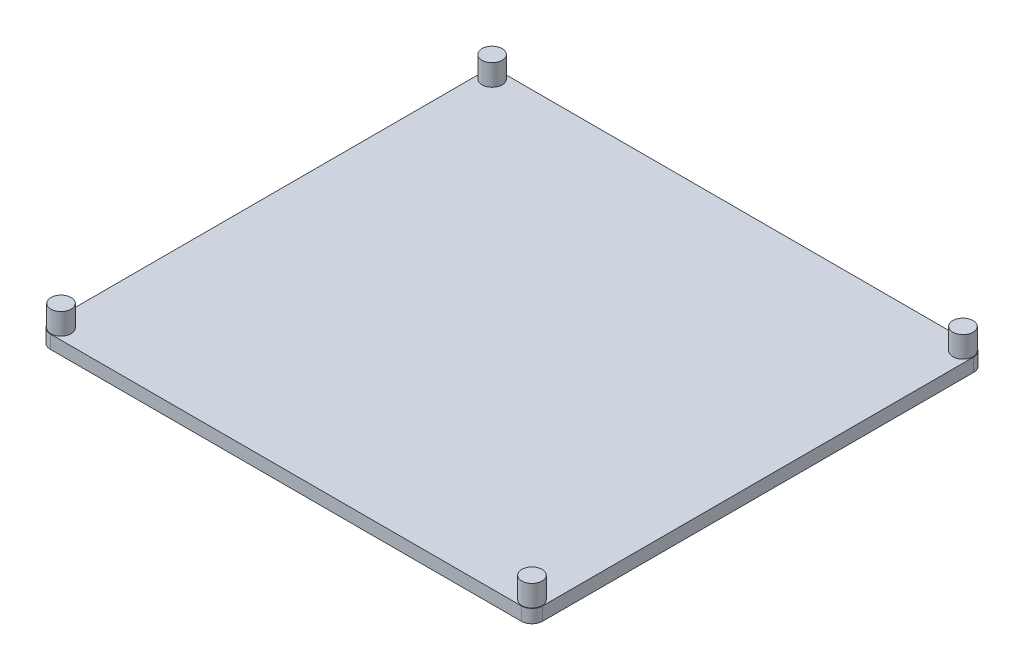
from build123d import *

# Parameters (mm, degrees)
BOSS_EXTRUDE1_DEPTH = 2.5
SKETCH3_R           = 1.9
BOSS_EXTRUDE2_DEPTH = 4
CUT_EXTRUDE1_DEPTH  = 1.5


with BuildPart() as part:
    # Sketch1 → Boss-Extrude1 (new body)
    with BuildSketch(Plane(origin=(0, 0, 0), x_dir=(1, 0, 0), z_dir=(0, 1, 0))):
        with BuildLine():
            Line((0, 0), (88.5, 0))
            ThreePointArc((88.5, 0), (89.914213562, 0.585786438), (90.5, 2))
            Line((90.5, 2), (90.5, 83))
            ThreePointArc((90.5, 83), (89.914213562, 84.414213562), (88.5, 85))
            Line((88.5, 85), (0, 85))
            ThreePointArc((0, 85), (-1.414213562, 84.414213562), (-2, 83))
            Line((-2, 83), (-2, 2))
            ThreePointArc((-2, 2), (-1.414213562, 0.585786438), (0, 0))
        make_face()
    extrude(amount=BOSS_EXTRUDE1_DEPTH)

    # Sketch3 → Boss-Extrude2 (add)
    with BuildSketch(Plane(origin=(0, 2.5, 0), x_dir=(1, 0, 0), z_dir=(0, 1, 0))):
        with Locations(Location((0, 83, 0), (0, 0, 270))):
            Circle(SKETCH3_R)
        with Locations(Location((88.5, 83, 0), (0, 0, 270))):
            Circle(SKETCH3_R)
        with Locations(Location((88.5, 2, 0), (0, 0, 270))):
            Circle(SKETCH3_R)
        with Locations(Location((0, 2, 0), (0, 0, 270))):
            Circle(SKETCH3_R)
    extrude(amount=BOSS_EXTRUDE2_DEPTH)

    # Sketch4 → Cut-Extrude1 (cut)
    # profile 1 of 7: a face of its own
    with BuildSketch(Plane.XZ):
        with BuildLine():
            Line((54.173268609, -47.534433423), (53.197707712, -47.534433423))
            add(Edge.make_bspline(
                [(53.197707712, -47.534433423), (53.14995199, -47.534186304), (53.057389515, -47.533707325), (52.922800548, -47.526106278), (52.796695362, -47.516001404), (52.679296801, -47.499051023), (52.569840971, -47.481475713), (52.469439078, -47.455679366), (52.377250132, -47.427186361), (52.266550076, -47.383346005), (52.140945694, -47.315261381), (52.005944486, -47.214285413), (51.888593199, -47.093223381), (51.78880982, -46.955263647), (51.708731536, -46.803492306), (51.651531343, -46.641174767), (51.614783762, -46.471041829), (51.611052011, -46.354399969), (51.609166045, -46.295451051)],
                knots=[0, 0, 0, 0, 1.00128172, 1.940733171, 2.826250472, 3.653024905, 4.427672124, 5.149348099, 5.824709082, 6.450061444, 7.643590664, 8.808605388, 9.972104426, 11.165284501, 12.367876273, 13.557044126, 14.765369432, 16, 16, 16, 16], degree=3))
            add(Edge.make_bspline(
                [(51.609166045, -46.295451051), (51.610706529, -46.240226063), (51.613733725, -46.131703753), (51.643306985, -45.973509427), (51.687947104, -45.822448027), (51.752365506, -45.679975325), (51.834504382, -45.547343225), (51.934438668, -45.426814093), (52.052933341, -45.320754311), (52.141899796, -45.261730533), (52.187090724, -45.231749128)],
                knots=[0, 0, 0, 0, 1.044356178, 2.052258378, 3.035953355, 4.020338374, 5.002448483, 5.980768927, 6.974322109, 8, 8, 8, 8], degree=3))
            add(Edge.make_bspline(
                [(52.187090724, -45.231749128), (52.130286082, -45.209951764), (52.021604731, -45.168248008), (51.871851615, -45.094230684), (51.742785615, -45.014342591), (51.632743424, -44.927998173), (51.540535844, -44.83237804), (51.458393628, -44.730000413), (51.388682055, -44.617299826), (51.32920253, -44.496718448), (51.282085295, -44.368894832), (51.249379382, -44.234785252), (51.228637187, -44.095908684), (51.225924767, -44.001520926), (51.22455066, -43.953704257)],
                knots=[0, 0, 0, 0, 1.272200328, 2.434034374, 3.488177493, 4.442517805, 5.351202203, 6.260825393, 7.183200622, 8.11705787, 9.069326169, 10.026320267, 11.000137371, 12, 12, 12, 12], degree=3))
            add(Edge.make_bspline(
                [(51.22455066, -43.953704257), (51.225946289, -43.90489452), (51.228692226, -43.808859997), (51.248947416, -43.667780074), (51.283253171, -43.532962984), (51.330471797, -43.403511327), (51.392023652, -43.280183265), (51.466384691, -43.162009574), (51.55563362, -43.050741608), (51.656136693, -42.94476473), (51.768269207, -42.847853454), (51.891830464, -42.76457109), (52.023653719, -42.692636688), (52.165544132, -42.634805464), (52.316494895, -42.589534193), (52.476541369, -42.558233711), (52.645592676, -42.537058739), (52.76160829, -42.535323377), (52.821105147, -42.534433423)],
                knots=[0, 0, 0, 0, 0.978522333, 1.925270105, 2.85076145, 3.763600118, 4.682725947, 5.609499657, 6.557784645, 7.537954401, 8.534920712, 9.522742111, 10.520247711, 11.5409147, 12.58930695, 13.675078472, 14.807699069, 16, 16, 16, 16], degree=3))
            Line((52.821105147, -42.534433423), (54.173268609, -42.534433423))
            Line((54.173268609, -42.534433423), (54.173268609, -47.534433423))
        make_face()
        with BuildLine():
            Line((53.72455066, -47.02161291), (53.72455066, -45.419048808))
            Line((53.72455066, -45.419048808), (53.423068288, -45.419048808))
            add(Edge.make_bspline(
                [(53.423068288, -45.419048808), (53.378998184, -45.419615372), (53.293845761, -45.42071009), (53.170203918, -45.423944774), (53.055722029, -45.432605396), (52.950005636, -45.441765448), (52.853763215, -45.455869994), (52.766672838, -45.473130179), (52.687951298, -45.49122425), (52.597212036, -45.522084933), (52.494298153, -45.567216366), (52.385357174, -45.638971791), (52.287305396, -45.722049059), (52.206418338, -45.820591682), (52.139076927, -45.927008802), (52.093738569, -46.042093976), (52.06212698, -46.161881337), (52.05931281, -46.244492897), (52.057883994, -46.286436628)],
                knots=[0, 0, 0, 0, 1.156584208, 2.234756387, 3.244705828, 4.168772894, 5.018724976, 5.795346628, 6.498686023, 7.135894168, 8.308330183, 9.43588092, 10.547699294, 11.667188675, 12.76860303, 13.837480448, 14.902040606, 16, 16, 16, 16], degree=3))
            add(Edge.make_bspline(
                [(52.057883994, -46.286436628), (52.058580851, -46.314204294), (52.059947812, -46.368673602), (52.072834694, -46.448032256), (52.090618438, -46.523550332), (52.119948262, -46.593191997), (52.154696523, -46.659402654), (52.199235493, -46.720090836), (52.250593024, -46.776900591), (52.310469468, -46.828309188), (52.378620061, -46.874805297), (52.457203656, -46.913511087), (52.544083754, -46.947908452), (52.641072078, -46.973982459), (52.746236709, -46.996618849), (52.861182085, -47.010893231), (52.985215466, -47.020063319), (53.071153466, -47.021084859), (53.115576301, -47.02161291)],
                knots=[0, 0, 0, 0, 0.911412742, 1.787835618, 2.63643285, 3.453173233, 4.262886967, 5.08783453, 5.918594724, 6.773969545, 7.67442701, 8.62112486, 9.645634318, 10.739428598, 11.916091468, 13.177237585, 14.540865421, 16, 16, 16, 16], degree=3))
            Line((53.115576301, -47.02161291), (53.72455066, -47.02161291))
        make_face(mode=Mode.SUBTRACT)
        with BuildLine():
            Line((53.72455066, -44.906228295), (53.72455066, -43.047253936))
            Line((53.72455066, -43.047253936), (53.085528224, -43.047253936))
            add(Edge.make_bspline(
                [(53.085528224, -43.047253936), (53.039791474, -43.047854861), (52.951639918, -43.049013065), (52.824267388, -43.051761323), (52.706839664, -43.06195735), (52.598379037, -43.071732673), (52.499387345, -43.087702691), (52.408901723, -43.10316718), (52.328988905, -43.12592394), (52.235486293, -43.157237643), (52.130904562, -43.207281093), (52.016696376, -43.280874271), (51.916102722, -43.370516185), (51.830756055, -43.473733761), (51.759794043, -43.584804511), (51.710702345, -43.70394704), (51.67889372, -43.827181796), (51.675147421, -43.911445202), (51.673268609, -43.953704257)],
                knots=[0, 0, 0, 0, 1.16016216, 2.236059617, 3.229676189, 4.14889023, 4.996733752, 5.772278665, 6.474820656, 7.101410824, 8.271817372, 9.403828207, 10.537358096, 11.673541442, 12.791884111, 13.865947414, 14.929748409, 16, 16, 16, 16], degree=3))
            add(Edge.make_bspline(
                [(51.673268609, -43.953704257), (51.673652132, -43.980127277), (51.674412992, -44.032547112), (51.686372952, -44.109511941), (51.702970316, -44.184435015), (51.72743017, -44.256298631), (51.757019942, -44.326340269), (51.796056391, -44.392280901), (51.840089215, -44.456927518), (51.908289402, -44.539617697), (52.008839875, -44.633740697), (52.151775922, -44.724741472), (52.313390477, -44.799319444), (52.430883859, -44.830847279), (52.491577904, -44.847133744)],
                knots=[0, 0, 0, 0, 0.723354195, 1.435040621, 2.129761981, 2.824182007, 3.512608497, 4.209435533, 4.920062464, 5.654614313, 7.143585817, 8.671381114, 10.280521501, 12, 12, 12, 12], degree=3))
            add(Edge.make_bspline(
                [(52.491577904, -44.847133744), (52.515905161, -44.85206991), (52.568651672, -44.862772536), (52.654662938, -44.874062875), (52.7531863, -44.884190677), (52.863800651, -44.891485523), (52.986945919, -44.899316414), (53.122582543, -44.902253475), (53.270806411, -44.905838314), (53.373652784, -44.906094976), (53.427074699, -44.906228295)],
                knots=[0, 0, 0, 0, 0.634452549, 1.375623993, 2.216454381, 3.166361212, 4.209414599, 5.370755378, 6.634280627, 8, 8, 8, 8], degree=3))
            Line((53.427074699, -44.906228295), (53.72455066, -44.906228295))
        make_face(mode=Mode.SUBTRACT)
    # profile 2 of 7: a face of its own
    with BuildSketch(Plane.XZ):
        Polygon((48.147627583, -47.534433423), (45.839935276, -42.534433423), (46.327715724, -42.534433423), (47.066898417, -44.136997526), (49.333525019, -44.136997526), (50.093741365, -42.534433423), (50.583525019, -42.534433423), (48.211730147, -47.534433423), align=None)
        Polygon((48.184686878, -46.559874128), (49.090135596, -44.649818039), (47.303276622, -44.649818039), align=None, mode=Mode.SUBTRACT)
    # profile 3 of 7: a face of its own
    with BuildSketch(Plane.XZ):
        Polygon((45.647627583, -47.02161291), (45.647627583, -47.534433423), (43.019422455, -47.534433423), (43.019422455, -47.02161291), (44.109166045, -47.02161291), (44.109166045, -42.534433423), (44.557883994, -42.534433423), (44.557883994, -47.02161291), align=None)
    # profile 4 of 7: a face of its own
    with BuildSketch(Plane.XZ):
        Polygon((42.698909635, -47.02161291), (42.698909635, -47.534433423), (40.070704506, -47.534433423), (40.070704506, -47.02161291), (41.160448096, -47.02161291), (41.160448096, -42.534433423), (41.609166045, -42.534433423), (41.609166045, -47.02161291), align=None)
    # profile 5 of 7: a face of its own
    with BuildSketch(Plane.XZ):
        Polygon((39.173268609, -47.534433423), (36.352755788, -47.534433423), (36.352755788, -47.02161291), (38.72455066, -47.02161291), (38.72455066, -45.483151372), (36.352755788, -45.483151372), (36.352755788, -44.970330859), (38.72455066, -44.970330859), (38.72455066, -43.047253936), (36.352755788, -43.047253936), (36.352755788, -42.534433423), (39.173268609, -42.534433423), align=None)
    # profile 6 of 7: a face of its own
    with BuildSketch(Plane.XZ):
        with BuildLine():
            Line((35.455319891, -47.534433423), (34.454718929, -47.534433423))
            add(Edge.make_bspline(
                [(34.454718929, -47.534433423), (34.387945889, -47.534211157), (34.259734254, -47.533784383), (34.076058153, -47.531404721), (33.9091623, -47.524584213), (33.759133959, -47.518714808), (33.62597588, -47.508012035), (33.50927975, -47.497782539), (33.40958304, -47.484391595), (33.349231824, -47.471955277), (33.321906429, -47.466324449)],
                knots=[0, 0, 0, 0, 1.410062039, 2.707475311, 3.878576406, 4.937260626, 5.877586885, 6.699081471, 7.410979367, 8, 8, 8, 8], degree=3))
            add(Edge.make_bspline(
                [(33.321906429, -47.466324449), (33.285324922, -47.457287213), (33.21294229, -47.439405531), (33.108736845, -47.401591582), (33.009397701, -47.357902828), (32.915288641, -47.306196831), (32.826434323, -47.247346711), (32.742843701, -47.18111589), (32.66563756, -47.106936905), (32.592069025, -47.02788254), (32.527829641, -46.940510867), (32.469997154, -46.849255765), (32.421448762, -46.752360347), (32.383246596, -46.650313332), (32.351220602, -46.544115748), (32.329696143, -46.43271822), (32.316290334, -46.316483178), (32.31496584, -46.237395626), (32.31429425, -46.197294)],
                knots=[0, 0, 0, 0, 1.027276577, 2.032638556, 3.019345632, 3.985365262, 4.957888996, 5.923693931, 6.890056973, 7.876427719, 8.865527834, 9.843495157, 10.821038291, 11.815616373, 12.812734995, 13.843357168, 14.906466538, 16, 16, 16, 16], degree=3))
            add(Edge.make_bspline(
                [(32.31429425, -46.197294), (32.316392764, -46.130672345), (32.320487509, -46.000676242), (32.358666989, -45.812018911), (32.421202093, -45.636030259), (32.507388469, -45.472955204), (32.617092646, -45.325886603), (32.748932121, -45.197148358), (32.902233597, -45.088423044), (33.045617247, -45.013827896), (33.172334938, -44.96583018), (33.276963038, -44.931889277), (33.391181272, -44.906107881), (33.513351007, -44.882676195), (33.644415893, -44.864795936), (33.784111999, -44.852097554), (33.932788712, -44.843932398), (34.034702657, -44.842739434), (34.087130788, -44.842125731)],
                knots=[0, 0, 0, 0, 1.260402266, 2.459371274, 3.627181936, 4.786749125, 5.93865593, 7.087644312, 8.261344208, 9.485713728, 10.136162886, 10.825977872, 11.566646758, 12.35154167, 13.181268117, 14.0701832, 15.007234106, 16, 16, 16, 16], degree=3))
            Line((34.087130788, -44.842125731), (32.250191686, -42.534433423))
            Line((32.250191686, -42.534433423), (32.805079506, -42.534433423))
            Line((32.805079506, -42.534433423), (34.642018609, -44.842125731))
            Line((34.642018609, -44.842125731), (35.006601942, -44.842125731))
            Line((35.006601942, -44.842125731), (35.006601942, -42.534433423))
            Line((35.006601942, -42.534433423), (35.455319891, -42.534433423))
            Line((35.455319891, -42.534433423), (35.455319891, -47.534433423))
        make_face()
        with BuildLine():
            Line((35.006601942, -47.02161291), (35.006601942, -45.354946244))
            Line((35.006601942, -45.354946244), (34.091137199, -45.347935026))
            add(Edge.make_bspline(
                [(34.091137199, -45.347935026), (34.048394281, -45.347916105), (33.965546331, -45.347879432), (33.845688312, -45.353584974), (33.734087904, -45.360074928), (33.631173372, -45.370004234), (33.536894114, -45.382793138), (33.451312402, -45.398815287), (33.374239112, -45.41740281), (33.284635338, -45.446465836), (33.183427728, -45.490525551), (33.075705842, -45.558843967), (32.981506137, -45.641465022), (32.903189483, -45.73713577), (32.840285458, -45.842776048), (32.796593009, -45.95599506), (32.76779994, -46.075008929), (32.764626512, -46.156726237), (32.763012199, -46.198295603)],
                knots=[0, 0, 0, 0, 1.146399208, 2.222048177, 3.218135709, 4.144938032, 4.994811973, 5.769438708, 6.479732432, 7.119818093, 8.294689872, 9.430121864, 10.527913442, 11.641375077, 12.733452768, 13.811150417, 14.886538365, 16, 16, 16, 16], degree=3))
            add(Edge.make_bspline(
                [(32.763012199, -46.198295603), (32.764708251, -46.238512857), (32.768069208, -46.318208781), (32.796134562, -46.434618972), (32.841960839, -46.545309784), (32.90468525, -46.648758041), (32.982752507, -46.741966382), (33.07368328, -46.821473229), (33.175337764, -46.887525252), (33.269578085, -46.931106537), (33.354427564, -46.956749834), (33.427758337, -46.975364274), (33.51133825, -46.988400985), (33.604183578, -47.000391276), (33.706702183, -47.010545215), (33.81895654, -47.0172849), (33.940866386, -47.021313221), (34.025361979, -47.021510689), (34.069101942, -47.02161291)],
                knots=[0, 0, 0, 0, 1.100596872, 2.180981401, 3.259506136, 4.371595435, 5.481727359, 6.576991111, 7.667816242, 8.793363246, 9.406619729, 10.09427138, 10.864108636, 11.721733836, 12.6590937, 13.685439239, 14.801845161, 16, 16, 16, 16], degree=3))
            Line((34.069101942, -47.02161291), (35.006601942, -47.02161291))
        make_face(mode=Mode.SUBTRACT)
    # profile 7 of 7: a face of its own
    with BuildSketch(Plane.XZ):
        Polygon((31.609166045, -47.534433423), (31.095343929, -47.534433423), (29.781241365, -45.385995923), (28.469142006, -47.534433423), (27.955319891, -47.534433423), (29.557883994, -44.911236308), (29.557883994, -42.534433423), (30.006601942, -42.534433423), (30.006601942, -44.911236308), align=None)
    extrude(amount=-CUT_EXTRUDE1_DEPTH, mode=Mode.SUBTRACT)


solid = part.part
